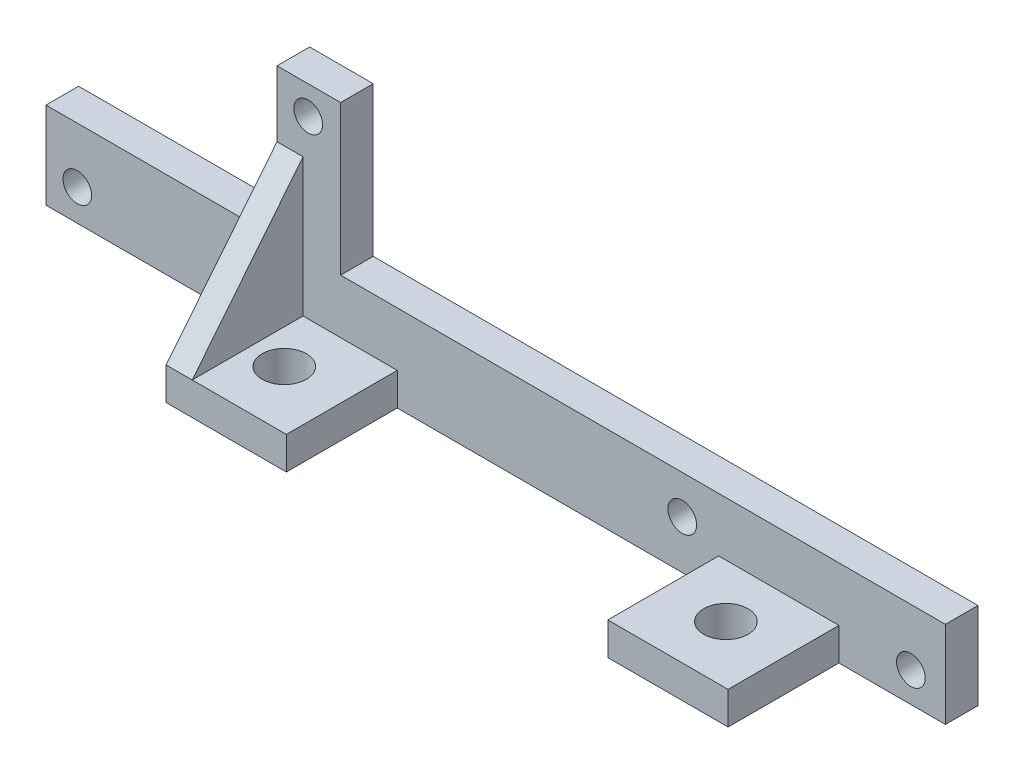
from build123d import *

# Parameters (mm, degrees)
SKETCH1_W           = 86
SKETCH1_H           = 23
BOSS_EXTRUDE1_DEPTH = 3.175
BOSS_EXTRUDE2_DEPTH = 3.175
SKETCH18_R          = 2.159
CUT_EXTRUDE2_DEPTH  = 127
SKETCH19_R          = 1.397
CUT_EXTRUDE3_DEPTH  = 47.652019249
SKETCH28_W          = 1.563549178
SKETCH28_H          = 8.443792612
BOSS_EXTRUDE4_DEPTH = 3.175
SKETCH27_W          = 57.315527743
SKETCH27_H          = 14.55620742
SKETCH27_W_2        = 22.489872753
CUT_EXTRUDE5_DEPTH  = 3.175
SKETCH29_W          = 13.689872798
SKETCH29_H          = 10.795
SKETCH29_W_2        = 13.689872764
CUT_EXTRUDE6_DEPTH  = 50.8
RIB3_REACH          = 68.958
SKETCH30_WALL_W     = 153.142504754
SKETCH30_WALL_H     = 2.54


with BuildPart() as part:
    # Sketch1 → Boss-Extrude1 (new body)
    with BuildSketch(Plane.XY):
        Rectangle(SKETCH1_W, SKETCH1_H)
    extrude(amount=-BOSS_EXTRUDE1_DEPTH)

    # Sketch3 → Boss-Extrude2 (add)
    with BuildSketch(Plane(origin=(0, -11.5, 0), x_dir=(-1, 0, 0), z_dir=(0, -1, 0))):
        Polygon((34.200000011, 0), (34.200000011, -10.795), (8.80000001, -10.795), (8.800000011, 0), align=None)
        Polygon((-34.200000011, 0), (-34.200000011, -10.795), (-8.80000001, -10.795), (-8.800000011, 0), align=None)
    extrude(amount=-BOSS_EXTRUDE2_DEPTH)

    # Sketch18 → Cut-Extrude2 (cut)
    with BuildSketch(Plane(origin=(0, 11.5, 0), x_dir=(1, 0, 0), z_dir=(0, 1, 0))):
        with Locations(Location((-14.626260209, -5.177433052, 0), (0, 0, 270))):
            Circle(SKETCH18_R)
        with Locations(Location((28.373739812, -5.177433052, 0), (0, 0, 90))):
            Circle(SKETCH18_R)
    extrude(amount=-CUT_EXTRUDE2_DEPTH, mode=Mode.SUBTRACT)

    # Sketch19 → Cut-Extrude3 (cut, through all)
    with BuildSketch(Plane(origin=(0, 0, -3.175), x_dir=(-1, 0, 0), z_dir=(0, 0, -1))):
        with Locations((-41.206, -8.579)):
            Circle(SKETCH19_R)
        with Locations((-18.9429, -6.801)):
            Circle(SKETCH19_R)
        with Locations((17.473, 8.7438)):
            Circle(SKETCH19_R)
        with Locations((39.952, -8.452)):
            Circle(SKETCH19_R)
    extrude(amount=-CUT_EXTRUDE3_DEPTH, mode=Mode.SUBTRACT)

    # Sketch28 → Boss-Extrude4 (add)
    with BuildSketch(Plane(origin=(0, 0, -3.175), x_dir=(-1, 0, 0), z_dir=(0, 0, -1))):
        with Locations((-43.781774589, -7.278103694)):
            Rectangle(SKETCH28_W, SKETCH28_H)
    extrude(amount=-BOSS_EXTRUDE4_DEPTH)

    # Sketch27 → Cut-Extrude5 (cut)
    with BuildSketch(Plane(origin=(0, 0, -3.175), x_dir=(-1, 0, 0), z_dir=(0, 0, -1))):
        with Locations((-14.342236128, 4.22189629)):
            Rectangle(SKETCH27_W, SKETCH27_H)
        with Locations((31.755063623, 4.22189629)):
            Rectangle(SKETCH27_W_2, SKETCH27_H)
    extrude(amount=-CUT_EXTRUDE5_DEPTH, mode=Mode.SUBTRACT)

    # Sketch29 → Cut-Extrude6 (cut)
    with BuildSketch(Plane(origin=(0, 11.5, 0), x_dir=(1, 0, 0), z_dir=(0, 1, 0))):
        with Locations((15.644936409, -5.3975)):
            Rectangle(SKETCH29_W, SKETCH29_H)
        with Locations((-27.355063629, -5.3975)):
            Rectangle(SKETCH29_W_2, SKETCH29_H)
    extrude(amount=-CUT_EXTRUDE6_DEPTH, mode=Mode.SUBTRACT)

    # Sketch30 wall → Rib3 (add, up to next)
    with BuildSketch(Plane(origin=(-20.510127247, -1.612609393, 5.3975), x_dir=(0, -0.779303981028, 0.626646076468), z_dir=(0, 0.626646076468, 0.779303981028)), mode=Mode.PRIVATE) as rib3_sk1:
        with Locations((0, 1.27)):
            Rectangle(SKETCH30_WALL_W, SKETCH30_WALL_H)
    rib3_tool1 = extrude(rib3_sk1.sketch, amount=-RIB3_REACH, mode=Mode.PRIVATE) - part.part
    add(rib3_tool1.solids().sort_by_distance((-20.510127247, -1.612609393, 5.3975))[0])


solid = part.part
